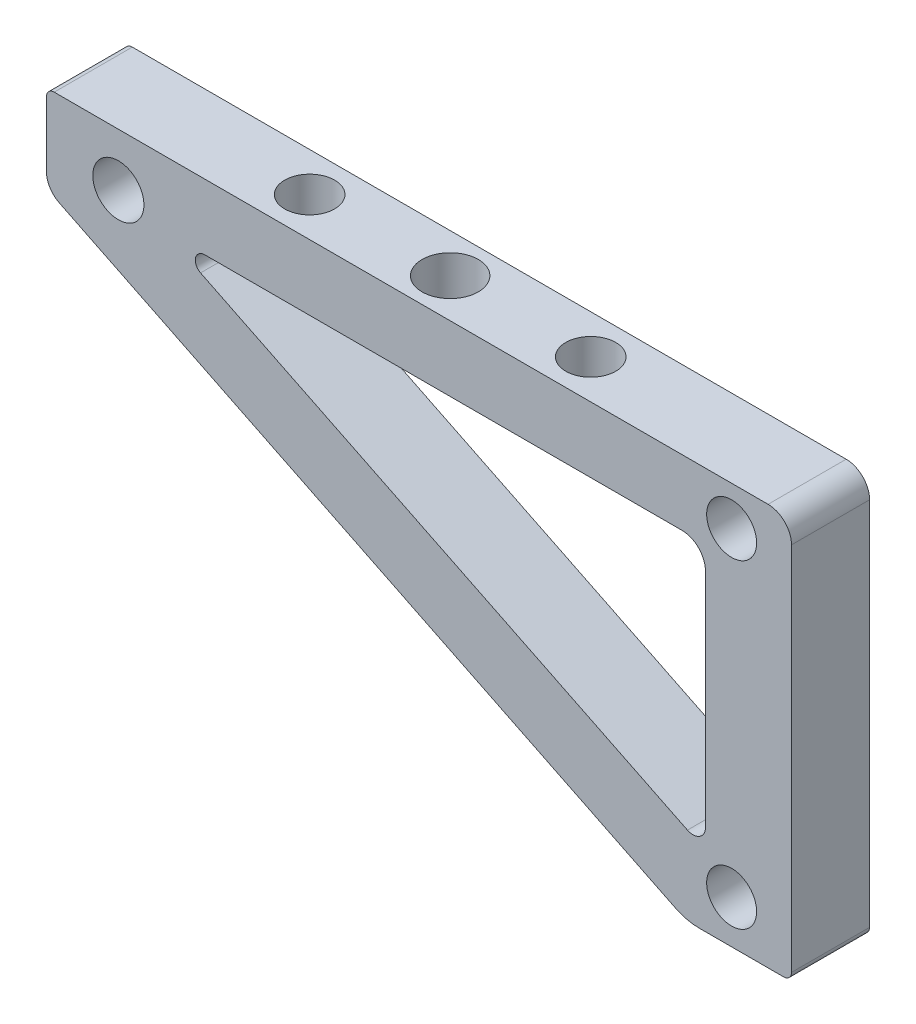
from build123d import *

# Parameters (mm, degrees)
BOSS_EXTRUDE1_DEPTH = 6.35
SKETCH5_R           = 2.032
CUT_EXTRUDE4_DEPTH  = 6.858
SKETCH6_R           = 2.286
CUT_EXTRUDE5_DEPTH  = 6.858
SKETCH7_R           = 2.078963723
SKETCH7_R_2         = 2.032
CUT_EXTRUDE6_DEPTH  = 44.972372637


with BuildPart() as part:
    # Sketch1 → Boss-Extrude1 (new body)
    with BuildSketch(Plane.XY):
        with BuildLine():
            Line((-39.734260423, 17.097332163), (-39.734260423, 11.839639722))
            ThreePointArc((-39.734260423, 11.839639722), (-39.446147588, 10.832316092), (-38.668957645, 10.129688385))
            Line((-38.668957645, 10.129688385), (11.411717792, -14.463177564))
            ThreePointArc((11.411717792, -14.463177564), (12.365282789, -14.803018024), (13.371011309, -14.91829111))
            Line((13.371011309, -14.91829111), (20.221726652, -14.91829111))
            ThreePointArc((20.221726652, -14.91829111), (20.670739459, -14.732303916), (20.856726652, -14.28329111))
            Line((20.856726652, -14.28329111), (20.856726652, 15.827332163))
            ThreePointArc((20.856726652, 15.827332163), (20.298765071, 17.174370581), (18.951726652, 17.732332163))
            Line((18.951726652, 17.732332163), (-39.099260423, 17.732332163))
            ThreePointArc((-39.099260423, 17.732332163), (-39.548273229, 17.546344969), (-39.734260423, 17.097332163))
        make_face()
        with BuildLine():
            Line((13.858514745, -7.578979228), (13.858514745, 10.493332163))
            ThreePointArc((13.858514745, 10.493332163), (13.300553163, 11.840370581), (11.953514745, 12.398332163))
            Line((11.953514745, 12.398332163), (-26.863603786, 12.398332163))
            ThreePointArc((-26.863603786, 12.398332163), (-27.605842685, 11.808742766), (-27.199482675, 10.952351628))
            Line((-27.199482675, 10.952351628), (12.394676227, -8.490953274))
            ThreePointArc((12.394676227, -8.490953274), (13.379754015, -8.441319049), (13.858514745, -7.578979228))
        make_face(mode=Mode.SUBTRACT)
    extrude(amount=BOSS_EXTRUDE1_DEPTH)

    # Sketch5 → Cut-Extrude4 (cut)
    with BuildSketch(Plane(origin=(0, 17.732332163, 0), x_dir=(1, 0, 0), z_dir=(0, 1, 0))):
        with Locations(Location((-21.503766885, -3.175, 0), (0, 0, 180))):
            Circle(SKETCH5_R)
        with Locations((1.356233115, -3.175)):
            Circle(SKETCH5_R)
    extrude(amount=-CUT_EXTRUDE4_DEPTH, mode=Mode.SUBTRACT)

    # Sketch6 → Cut-Extrude5 (cut)
    with BuildSketch(Plane(origin=(0, 17.732332163, 0), x_dir=(1, 0, 0), z_dir=(0, 1, 0))):
        with Locations(Location((-10.073766885, -3.175, 0), (0, 0, 180))):
            Circle(SKETCH6_R)
    extrude(amount=-CUT_EXTRUDE5_DEPTH, mode=Mode.SUBTRACT)

    # Sketch7 → Cut-Extrude6 (cut, through all)
    with BuildSketch(Plane(origin=(0, 0, 0), x_dir=(-1, 0, 0), z_dir=(0, 0, -1))):
        with Locations((33.883843897, 13.433671695)):
            Circle(SKETCH7_R)
        with Locations((-15.98734669, 14.538238486)):
            Circle(SKETCH7_R_2)
        with Locations((-15.98734669, -11.419081089)):
            Circle(SKETCH7_R_2)
    extrude(amount=-CUT_EXTRUDE6_DEPTH, mode=Mode.SUBTRACT)


solid = part.part
